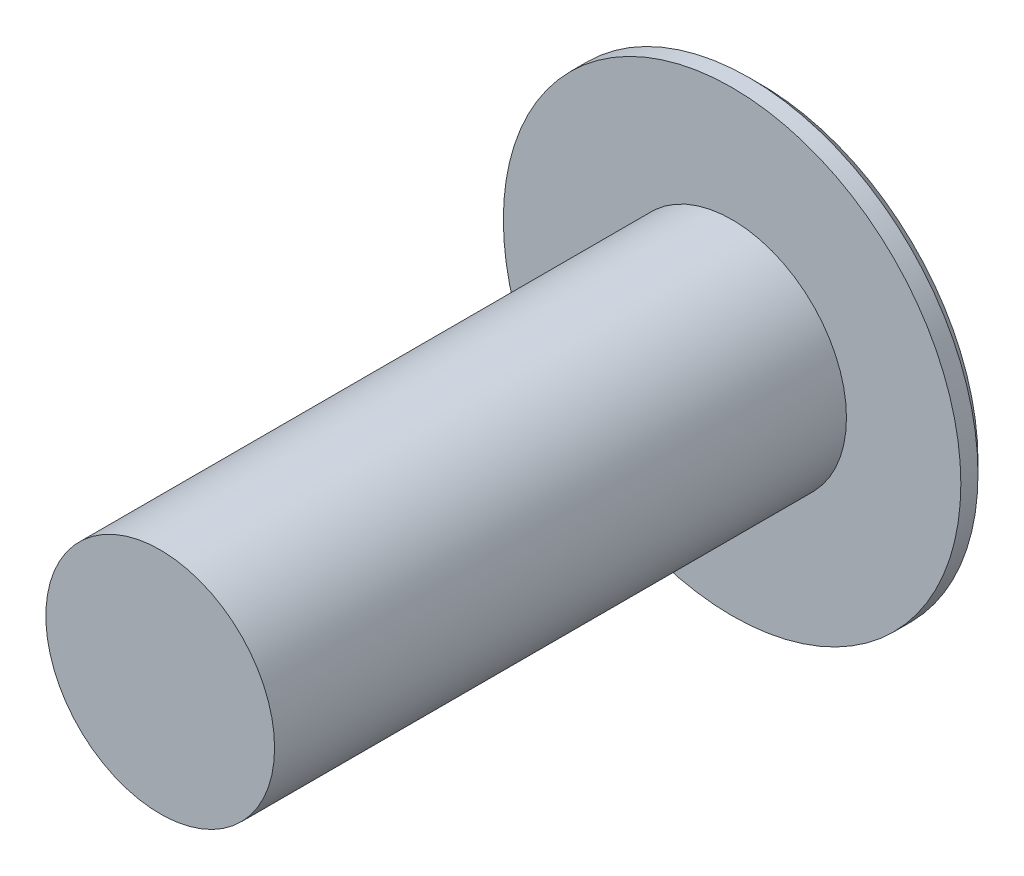
from build123d import *

# Parameters (mm, degrees)
SKETCH2_R           = 20
BOSS_EXTRUDE1_DEPTH = 100
SKETCH3_R           = 40
BOSS_EXTRUDE2_DEPTH = 5
CHAMFER1_SIZE       = 2


with BuildPart() as part:
    # Sketch2 → Boss-Extrude1 (new body)
    with BuildSketch(Plane.XY):
        Circle(SKETCH2_R)
    extrude(amount=BOSS_EXTRUDE1_DEPTH)

    # Sketch3 → Boss-Extrude2 (add)
    with BuildSketch(Plane(origin=(0, 0, 0), x_dir=(-1, 0, 0), z_dir=(0, 0, -1))):
        Circle(SKETCH3_R)
    extrude(amount=BOSS_EXTRUDE2_DEPTH)

    # Chamfer1
    chamfer1_edges = [part.edges().sort_by_distance(p)[0] for p in [
        (40, 0, -5),
    ]]
    chamfer(chamfer1_edges, length=CHAMFER1_SIZE)


solid = part.part
